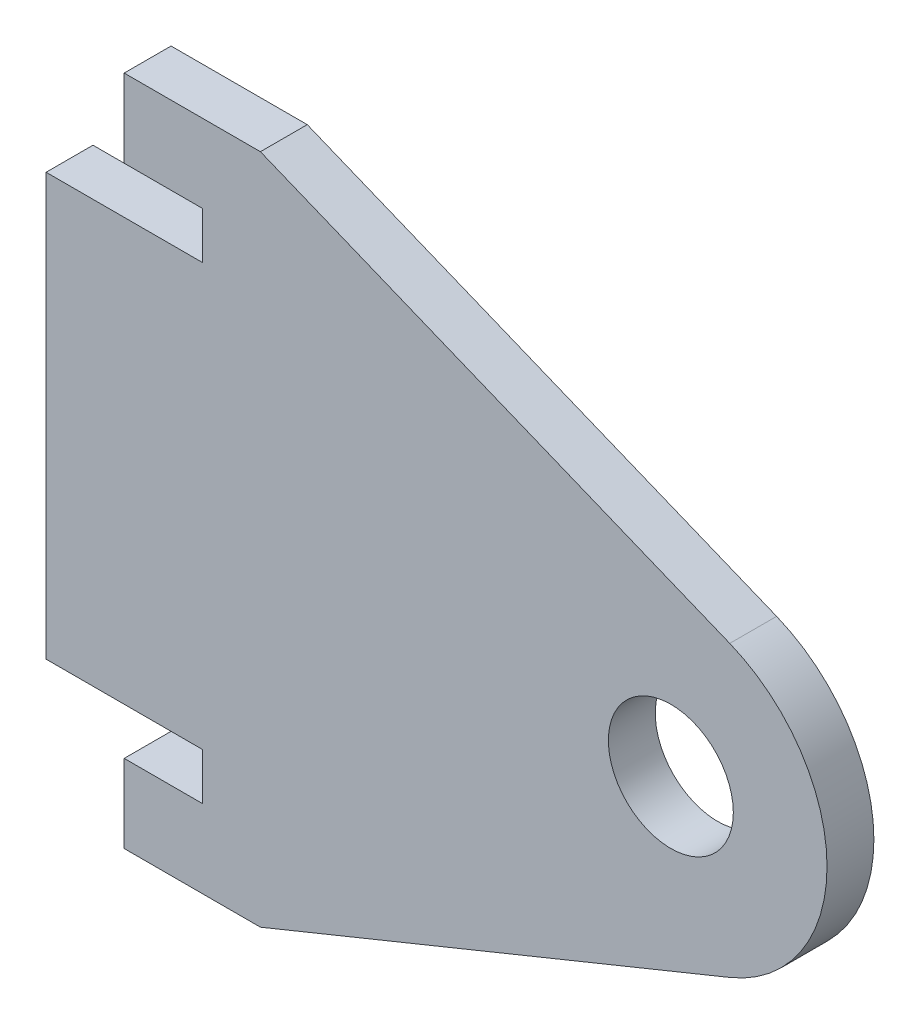
from build123d import *

# Parameters (mm, degrees)
ESQUISSE1_R             = 4
BOSS_EXTRU_1_DEPTH      = 3
ENL_V_MAT_EXTRU_1_REACH = 51.7
ESQUISSE2_W             = 5.860148805
ESQUISSE2_H             = 10.034501378
ESQUISSE2_H_2           = 10.034501379


with BuildPart() as part:
    # Esquisse1 → Boss.-Extru.1 (new body)
    with BuildSketch(Plane.XY):
        with BuildLine():
            Line((-11.661538462, 23.484615385), (-11.661538462, -3.515384615))
            Line((-11.661538462, -3.515384615), (-1.661538462, -3.515384615))
            Line((-1.661538462, -3.515384615), (-1.661538462, -6.515384615))
            Line((-1.661538462, -6.515384615), (-11.661538462, -6.515384615))
            Line((-11.661538462, -6.515384615), (-11.661538462, -11.515384615))
            Line((-11.661538462, -11.515384615), (2.059303641, -11.515384615))
            Line((2.059303641, -11.515384615), (32.110271991, 0.723219922))
            ThreePointArc((32.110271991, 0.723219922), (38.338461538, 9.984615385), (32.110271991, 19.246010847))
            Line((32.110271991, 19.246010847), (2.059303641, 31.484615385))
            Line((2.059303641, 31.484615385), (-11.661538462, 31.484615385))
            Line((-11.661538462, 31.484615385), (-11.661538462, 26.484615385))
            Line((-11.661538462, 26.484615385), (-1.661538462, 26.484615385))
            Line((-1.661538462, 26.484615385), (-1.661538462, 23.484615385))
            Line((-1.661538462, 23.484615385), (-11.661538462, 23.484615385))
        make_face()
        with Locations((28.338461538, 9.984615385)):
            Circle(ESQUISSE1_R, mode=Mode.SUBTRACT)
    extrude(amount=BOSS_EXTRU_1_DEPTH)

    # Esquisse2 → Enlèv. mat.-Extru.1 (cut, up to next)
    with BuildSketch(Plane.XY.offset(3), mode=Mode.PRIVATE) as enl_v_mat_extru_1_sk1:
        with Locations((-9.591612865, 30.1046068)):
            Rectangle(ESQUISSE2_W, ESQUISSE2_H)
    enl_v_mat_extru_1_tool1 = extrude(enl_v_mat_extru_1_sk1.sketch, amount=-ENL_V_MAT_EXTRU_1_REACH, mode=Mode.PRIVATE) & part.part
    # Esquisse2 → Enlèv. mat.-Extru.1 (cut, up to next)
    with BuildSketch(Plane.XY.offset(3), mode=Mode.PRIVATE) as enl_v_mat_extru_1_sk2:
        with Locations((-9.591612865, -10.135376031)):
            Rectangle(ESQUISSE2_W, ESQUISSE2_H_2)
    enl_v_mat_extru_1_tool2 = extrude(enl_v_mat_extru_1_sk2.sketch, amount=-ENL_V_MAT_EXTRU_1_REACH, mode=Mode.PRIVATE) & part.part
    add(enl_v_mat_extru_1_tool1.solids().sort_by_distance((-9.591613, 30.104607, 3))[0], mode=Mode.SUBTRACT)
    add(enl_v_mat_extru_1_tool2.solids().sort_by_distance((-9.591613, -10.135376, 3))[0], mode=Mode.SUBTRACT)


solid = part.part
